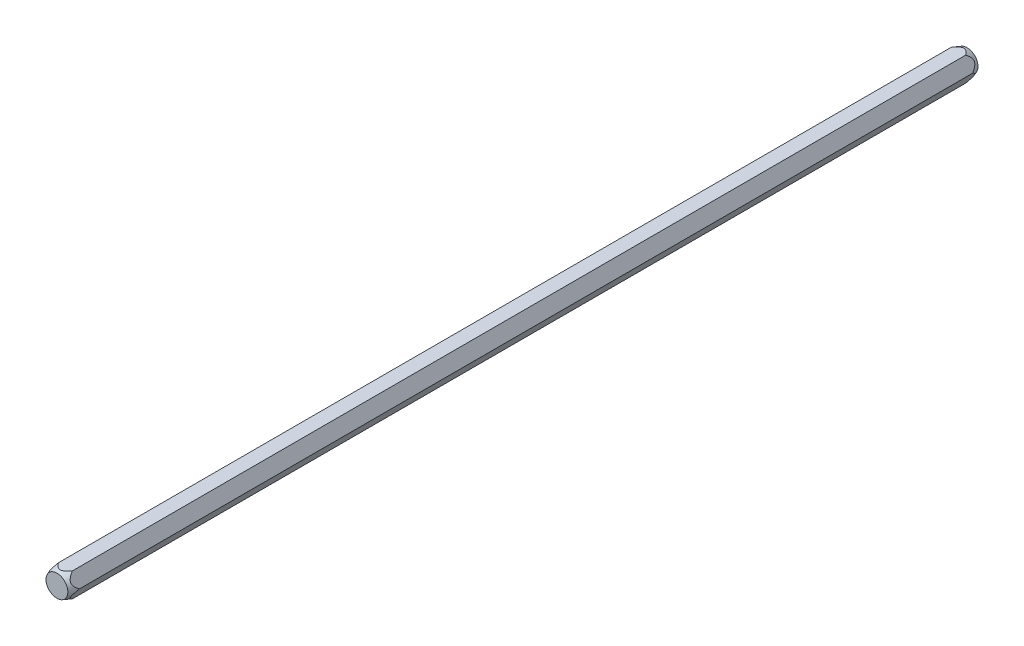
from build123d import *

# Parameters (mm, degrees)
SALIENTE_EXTRUIR1_DEPTH   = 150
CROQUIS2_OUTSIDE_W        = 38.098
CROQUIS2_OUTSIDE_H        = 37.48
CROQUIS2_OUTSIDE_R        = 1.8
CORTAR_EXTRUIR2_DEPTH     = 2
CORTAR_EXTRUIR2_DRAFT     = -20
SIMETR_A1_COPY_1_SKETCH_W = 38.098
SIMETR_A1_COPY_1_SKETCH_H = 37.48
SIMETR_A1_COPY_1_SKETCH_R = 1.8
SIMETR_A1_COPY_1_DEPTH    = 2
SIMETR_A1_COPY_1_DRAFT    = -20


with BuildPart() as part:
    # Croquis1 → Saliente-Extruir1 (new body)
    with BuildSketch(Plane.XY):
        Polygon((2.309401077, 0), (1.154700538, 2), (-1.154700538, 2), (-2.309401077, 0), (-1.154700538, -2), (1.154700538, -2), align=None)
    extrude(amount=SALIENTE_EXTRUIR1_DEPTH)


with BuildPart() as cortar_extruir2_tool:
    # Croquis2 outside → Cortar-Extruir2 (with draft: the straight prism first)
    with BuildSketch(Plane.XY.offset(150)):
        Rectangle(CROQUIS2_OUTSIDE_W, CROQUIS2_OUTSIDE_H)
        Circle(CROQUIS2_OUTSIDE_R, mode=Mode.SUBTRACT)
    extrude(amount=-CORTAR_EXTRUIR2_DEPTH)
    # Cortar-Extruir2: the draft: its side faces are tilted about the plane it starts from
    cortar_extruir2_sides = [cortar_extruir2_tool.faces().sort_by_distance(p)[0] for p in [
        (0, -18.74, 149),
        (19.049, 0, 149),
        (0, 18.74, 149),
        (-19.049, 0, 149),
        (-1.8, 0, 149),
    ]]
    draft(cortar_extruir2_sides, Plane.XY.offset(150), CORTAR_EXTRUIR2_DRAFT)


with BuildPart() as part_1:
    add(part.part)

    # Cortar-Extruir2: cut by cortar_extruir2_tool
    add(cortar_extruir2_tool.part, mode=Mode.SUBTRACT)


with BuildPart() as simetr_a1_copy_1_tool:
    # Simetría1 copy 1 sketch → Simetría1 copy 1 (with draft: the straight prism first)
    with BuildSketch(Plane(origin=(0, 0, 0), x_dir=(1, 0, 0), z_dir=(0, 0, -1))):
        Rectangle(SIMETR_A1_COPY_1_SKETCH_W, SIMETR_A1_COPY_1_SKETCH_H)
        Circle(SIMETR_A1_COPY_1_SKETCH_R, mode=Mode.SUBTRACT)
    extrude(amount=-SIMETR_A1_COPY_1_DEPTH)
    # Simetría1 copy 1: the draft: its side faces are tilted about the plane it starts from
    simetr_a1_copy_1_sides = [simetr_a1_copy_1_tool.faces().sort_by_distance(p)[0] for p in [
        (0, -18.74, 1),
        (19.049, 0, 1),
        (0, 18.74, 1),
        (-19.049, 0, 1),
        (-1.8, 0, 1),
    ]]
    draft(simetr_a1_copy_1_sides, Plane(origin=(0, 0, 0), x_dir=(1, 0, 0), z_dir=(0, 0, -1)), SIMETR_A1_COPY_1_DRAFT)


with BuildPart() as part_2:
    add(part_1.part)

    # Simetría1 copy 1: cut by simetr_a1_copy_1_tool
    add(simetr_a1_copy_1_tool.part, mode=Mode.SUBTRACT)


solid = part_2.part
